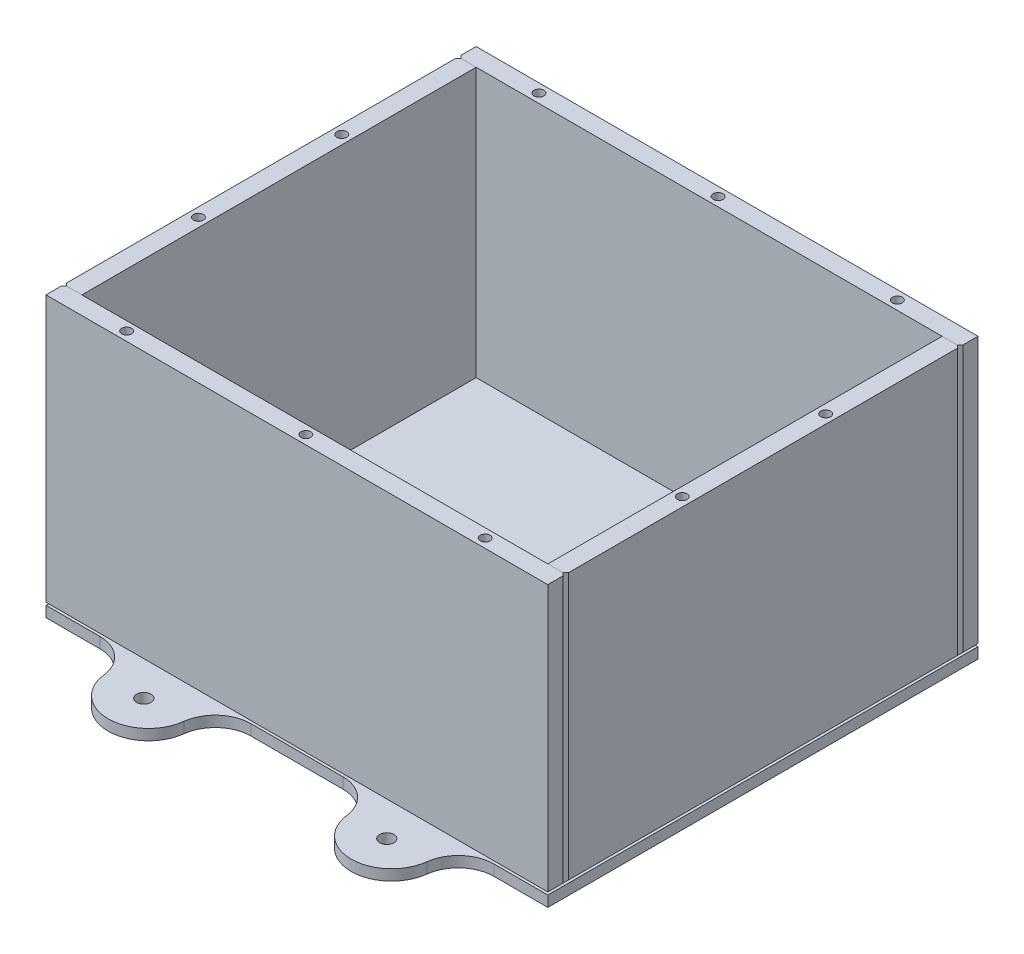
from build123d import *

# Parameters (mm, degrees)
CROQUIS1_R                             = 4
SALIENTE_EXTRUIR1_DEPTH                = 3
CROQUIS2_W                             = 280
CROQUIS2_H                             = 10
SALIENTE_EXTRUIR2_DEPTH                = 150
SALIENTE_EXTRUIR2_2_DEPTH              = 150
CROQUIS3_W                             = 10
CROQUIS3_H                             = 220
SALIENTE_EXTRUIR3_DEPTH                = 150
SALIENTE_EXTRUIR3_2_DEPTH              = 150
CHAFL_N1_SIZE                          = 1.5
CHAFL_N2_SIZE                          = 1.5
CHAFL_N3_SIZE                          = 1.5
CHAFL_N4_SIZE                          = 1.5
TALADRO_DE_MARGEN_PARA_M51_AT_2_COUNT  = 2
TALADRO_DE_MARGEN_PARA_M51_AT_2_PITCH  = 80
TALADRO_DE_MARGEN_PARA_M51_AT_3_COUNT  = 2
TALADRO_DE_MARGEN_PARA_M51_AT_3_PITCH  = 82.764726786
TALADRO_DE_MARGEN_PARA_M51_AT_4_COUNT  = 2
TALADRO_DE_MARGEN_PARA_M51_AT_4_PITCH  = 246.677927671
TALADRO_DE_MARGEN_PARA_M51_AT_5_COUNT  = 2
TALADRO_DE_MARGEN_PARA_M51_AT_5_PITCH  = 270
TALADRO_DE_MARGEN_PARA_M51_AT_6_COUNT  = 2
TALADRO_DE_MARGEN_PARA_M51_AT_6_PITCH  = 281.602556807
TALADRO_DE_MARGEN_PARA_M51_AT_7_COUNT  = 2
TALADRO_DE_MARGEN_PARA_M51_AT_7_PITCH  = 281.513765205
TALADRO_DE_MARGEN_PARA_M51_AT_8_COUNT  = 2
TALADRO_DE_MARGEN_PARA_M51_AT_8_PITCH  = 158.902485821
TALADRO_DE_MARGEN_PARA_M51_AT_9_COUNT  = 2
TALADRO_DE_MARGEN_PARA_M51_AT_9_PITCH  = 154.434452115
TALADRO_DE_MARGEN_PARA_M51_AT_10_COUNT = 2
TALADRO_DE_MARGEN_PARA_M51_AT_10_PITCH = 205.548047911


with BuildPart() as part:
    # Croquis1 → Saliente-Extruir1 (new, symmetric)
    with BuildSketch(Plane(origin=(0, 0, 0), x_dir=(1, 0, 0), z_dir=(0, 1, 0))):
        with BuildLine():
            Line((-25.590284919, 120), (25.590284919, 120))
            ThreePointArc((25.590284919, 120), (38.874508202, 125.049099968), (45.45139435, 137.647058824))
            ThreePointArc((45.45139435, 137.647058824), (67.79514246, 157.5), (90.138890569, 137.647058824))
            ThreePointArc((90.138890569, 137.647058824), (96.715776717, 125.049099968), (110, 120))
            Line((110, 120), (140, 120))
            Line((140, 120), (140, -120))
            Line((140, -120), (110, -120))
            ThreePointArc((110, -120), (96.715776717, -125.049099968), (90.138890569, -137.647058824))
            ThreePointArc((90.138890569, -137.647058824), (67.79514246, -157.5), (45.45139435, -137.647058824))
            ThreePointArc((45.45139435, -137.647058824), (38.874508202, -125.049099968), (25.590284919, -120))
            Line((25.590284919, -120), (-25.590284919, -120))
            ThreePointArc((-25.590284919, -120), (-38.874508202, -125.049099968), (-45.45139435, -137.647058824))
            ThreePointArc((-45.45139435, -137.647058824), (-67.79514246, -157.5), (-90.138890569, -137.647058824))
            ThreePointArc((-90.138890569, -137.647058824), (-96.715776717, -125.049099968), (-110, -120))
            Line((-110, -120), (-140, -120))
            Line((-140, -120), (-140, 120))
            Line((-140, 120), (-110, 120))
            ThreePointArc((-110, 120), (-96.715776717, 125.049099968), (-90.138890569, 137.647058824))
            ThreePointArc((-90.138890569, 137.647058824), (-67.79514246, 157.5), (-45.45139435, 137.647058824))
            ThreePointArc((-45.45139435, 137.647058824), (-38.874508202, 125.049099968), (-25.590284919, 120))
        make_face()
        with Locations(Location((-67.79514246, 137.647058824, 0), (0, 0, 270))):
            Circle(CROQUIS1_R, mode=Mode.SUBTRACT)
        with Locations(Location((67.79514246, 137.647058824, 0), (0, 0, 90))):
            Circle(CROQUIS1_R, mode=Mode.SUBTRACT)
        with Locations(Location((67.79514246, -137.647058824, 0), (0, 0, 270))):
            Circle(CROQUIS1_R, mode=Mode.SUBTRACT)
        with Locations(Location((-67.79514246, -137.647058824, 0), (0, 0, 90))):
            Circle(CROQUIS1_R, mode=Mode.SUBTRACT)
    extrude(amount=SALIENTE_EXTRUIR1_DEPTH, both=True)


with BuildPart() as body_2:
    # Croquis2 → Saliente-Extruir2 (new body)
    with BuildSketch(Plane(origin=(0, 3, 0), x_dir=(1, 0, 0), z_dir=(0, 1, 0))):
        with Locations((0, 115)):
            Rectangle(CROQUIS2_W, CROQUIS2_H)
    extrude(amount=SALIENTE_EXTRUIR2_DEPTH)

    # Chaflán2
    chafl_n2_edges = [body_2.edges().sort_by_distance(p)[0] for p in [
        (0, 3, -120),
        (140, 3, -115),
        (-140, 3, -115),
        (140, 78, -110),
        (-140, 78, -110),
    ]]
    chamfer(chafl_n2_edges, length=CHAFL_N2_SIZE)


with BuildPart() as body_3:
    # Croquis2 → Saliente-Extruir2 2 (new body)
    with BuildSketch(Plane(origin=(0, 3, 0), x_dir=(1, 0, 0), z_dir=(0, 1, 0))):
        with Locations((0, -115)):
            Rectangle(CROQUIS2_W, CROQUIS2_H)
    extrude(amount=SALIENTE_EXTRUIR2_2_DEPTH)

    # Chaflán3
    chafl_n3_edges = [body_3.edges().sort_by_distance(p)[0] for p in [
        (140, 3, 115),
        (0, 3, 120),
        (-140, 3, 115),
        (-140, 78, 110),
        (140, 78, 110),
    ]]
    chamfer(chafl_n3_edges, length=CHAFL_N3_SIZE)


with BuildPart() as body_4:
    # Croquis3 → Saliente-Extruir3 (new body)
    with BuildSketch(Plane(origin=(0, 3, 0), x_dir=(1, 0, 0), z_dir=(0, 1, 0))):
        with Locations((-135, 0)):
            Rectangle(CROQUIS3_W, CROQUIS3_H)
    extrude(amount=SALIENTE_EXTRUIR3_DEPTH)

    # Chaflán1
    chafl_n1_edges = [body_4.edges().sort_by_distance(p)[0] for p in [
        (-140, 3, 0),
        (-140, 78, -110),
        (-140, 78, 110),
    ]]
    chamfer(chafl_n1_edges, length=CHAFL_N1_SIZE)

    # Croquis5 → Taladro de margen para M51 (revolve, cut)
    with BuildSketch(Plane(origin=(-135, 153, -40), x_dir=(0, 0, 1), z_dir=(1, 0, 0))):
        Polygon((0, 0), (0, 21.652366702), (2.75, 20), (2.75, 0), align=None)
    taladro_de_margen_para_m51 = revolve(axis=Axis((-135, 159.35, -40), (0, -1, 0)), mode=Mode.SUBTRACT)

    # Taladro de margen para M51 at 2: Taladro de margen para M51 ×2
    with Locations(*[(0, 0, i * TALADRO_DE_MARGEN_PARA_M51_AT_2_PITCH) for i in range(1, TALADRO_DE_MARGEN_PARA_M51_AT_2_COUNT)]):
        add(taladro_de_margen_para_m51, mode=Mode.SUBTRACT)


with BuildPart() as body_5:
    # Croquis3 → Saliente-Extruir3 2 (new body)
    with BuildSketch(Plane(origin=(0, 3, 0), x_dir=(1, 0, 0), z_dir=(0, 1, 0))):
        with Locations((135, 0)):
            Rectangle(CROQUIS3_W, CROQUIS3_H)
    extrude(amount=SALIENTE_EXTRUIR3_2_DEPTH)

    # Chaflán4
    chafl_n4_edges = [body_5.edges().sort_by_distance(p)[0] for p in [
        (140, 3, 0),
        (140, 78, 110),
        (140, 78, -110),
    ]]
    chamfer(chafl_n4_edges, length=CHAFL_N4_SIZE)

    # Taladro de margen para M51 at 5: Taladro de margen para M51 ×2
    with Locations(*[(i * TALADRO_DE_MARGEN_PARA_M51_AT_5_PITCH, 0, 0) for i in range(1, TALADRO_DE_MARGEN_PARA_M51_AT_5_COUNT)]):
        add(taladro_de_margen_para_m51, mode=Mode.SUBTRACT)

    # Taladro de margen para M51 at 6: Taladro de margen para M51 ×2
    with Locations(*[Vector(0.9587981127083872, 0, 0.284088329691374) * (i * TALADRO_DE_MARGEN_PARA_M51_AT_6_PITCH) for i in range(1, TALADRO_DE_MARGEN_PARA_M51_AT_6_COUNT)]):
        add(taladro_de_margen_para_m51, mode=Mode.SUBTRACT)


with BuildPart() as body_2_1:
    add(body_2.part)

    # Taladro de margen para M51 at 3: Taladro de margen para M51 ×2
    with Locations(*[Vector(0.42288546533112364, 0, -0.9061831399952656) * (i * TALADRO_DE_MARGEN_PARA_M51_AT_3_PITCH) for i in range(1, TALADRO_DE_MARGEN_PARA_M51_AT_3_COUNT)]):
        add(taladro_de_margen_para_m51, mode=Mode.SUBTRACT)

    # Taladro de margen para M51 at 4: Taladro de margen para M51 ×2
    with Locations(*[Vector(0.9526592112186827, 0, -0.3040401737931967) * (i * TALADRO_DE_MARGEN_PARA_M51_AT_4_PITCH) for i in range(1, TALADRO_DE_MARGEN_PARA_M51_AT_4_COUNT)]):
        add(taladro_de_margen_para_m51, mode=Mode.SUBTRACT)

    # Taladro de margen para M51 at 9: Taladro de margen para M51 ×2
    with Locations(*[Vector(0.8741572761215378, 0, -0.4856429311786321) * (i * TALADRO_DE_MARGEN_PARA_M51_AT_9_PITCH) for i in range(1, TALADRO_DE_MARGEN_PARA_M51_AT_9_COUNT)]):
        add(taladro_de_margen_para_m51, mode=Mode.SUBTRACT)


with BuildPart() as body_3_1:
    add(body_3.part)

    # Taladro de margen para M51 at 7: Taladro de margen para M51 ×2
    with Locations(*[Vector(0.8347726791573309, 0, 0.5505947458271755) * (i * TALADRO_DE_MARGEN_PARA_M51_AT_7_PITCH) for i in range(1, TALADRO_DE_MARGEN_PARA_M51_AT_7_COUNT)]):
        add(taladro_de_margen_para_m51, mode=Mode.SUBTRACT)

    # Taladro de margen para M51 at 8: Taladro de margen para M51 ×2
    with Locations(*[Vector(0.22026087143464346, 0, 0.9754410020677066) * (i * TALADRO_DE_MARGEN_PARA_M51_AT_8_PITCH) for i in range(1, TALADRO_DE_MARGEN_PARA_M51_AT_8_COUNT)]):
        add(taladro_de_margen_para_m51, mode=Mode.SUBTRACT)

    # Taladro de margen para M51 at 10: Taladro de margen para M51 ×2
    with Locations(*[Vector(0.6567807448042018, 0, 0.754081595886306) * (i * TALADRO_DE_MARGEN_PARA_M51_AT_10_PITCH) for i in range(1, TALADRO_DE_MARGEN_PARA_M51_AT_10_COUNT)]):
        add(taladro_de_margen_para_m51, mode=Mode.SUBTRACT)


solid = Compound([part.part, body_4.part, body_5.part, body_2_1.part, body_3_1.part])
